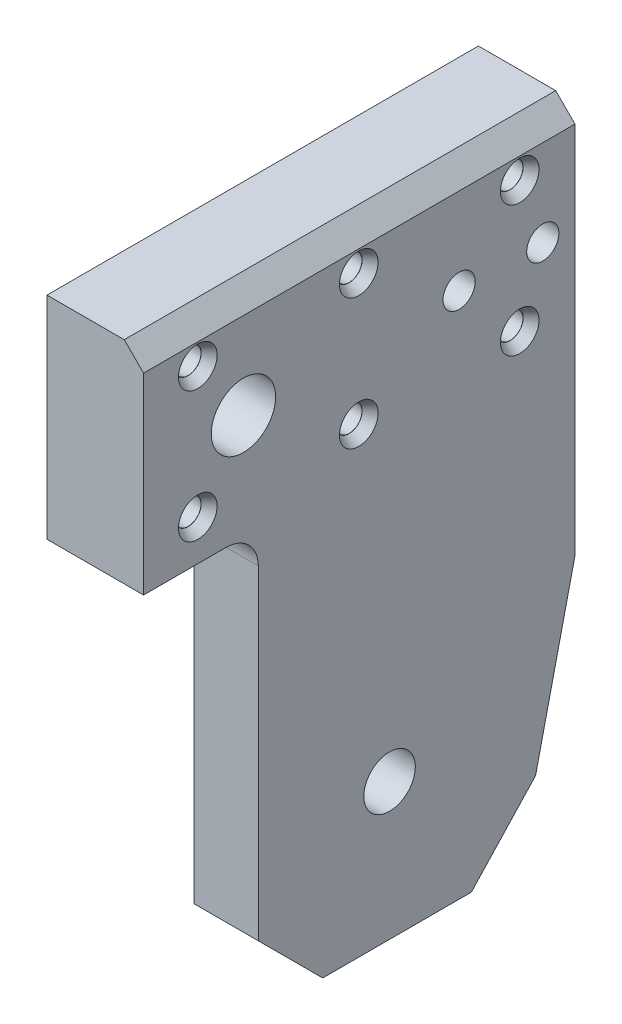
from build123d import *

# Parameters (mm, degrees)
SKETCH_1_R                      = 4
EXTRUDE_1_DEPTH                 = 15
SKETCH_4_W                      = 59.231964801
SKETCH_4_H                      = 71.825442386
CUT_EXTRUDE_3_DEPTH             = 5
SKETCH_5_R                      = 5
SKETCH_5_R_2                    = 2.5
CUT_EXTRUDE_1_DEPTH             = 109.069666358
CHAMFER_1_SIZE                  = 10
CHAMFER_2_SIZE                  = 7.5
CHAMFER_2_SIZE2                 = 10.967511122
FILLET_1_R                      = 5
SKETCH_6_R                      = 2
CUT_EXTRUDE_2_DEPTH             = 109.069666358
SKETCH_7_R                      = 3
CUT_EXTRUDE_3_2_DEPTH           = 1.5
CUT_EXTRUDE_3_2_DRAFT           = -33
CUT_EXTRUDE_3_2_PROFILE_2_DEPTH = 1.5
CUT_EXTRUDE_3_2_PROFILE_2_DRAFT = -33
CUT_EXTRUDE_3_2_PROFILE_3_DEPTH = 1.5
CUT_EXTRUDE_3_2_PROFILE_3_DRAFT = -33
CUT_EXTRUDE_3_2_PROFILE_4_DEPTH = 1.5
CUT_EXTRUDE_3_2_PROFILE_4_DRAFT = -33
CUT_EXTRUDE_3_2_PROFILE_5_DEPTH = 1.5
CUT_EXTRUDE_3_2_PROFILE_5_DRAFT = -33
CUT_EXTRUDE_3_2_PROFILE_6_DEPTH = 1.5
CUT_EXTRUDE_3_2_PROFILE_6_DRAFT = -33
CHAMFER_3_SIZE                  = 3


with BuildPart() as part:
    # Эскиз1 → Вытянуть1 (new body)
    with BuildSketch(Plane(origin=(0, 0, 0), x_dir=(0, 0, -1), z_dir=(1, 0, 0))):
        Polygon((-24.582546576, -0.000617064), (-24.582546576, -32.845704832), (-6.76628281, -32.845704832), (-6.76628281, -98.258905102), (33.827639979, -98.258905102), (42.417453424, -61.027347877), (42.417453424, -0.000617064), align=None)
        with Locations((13.620132913, -77.029686591)):
            Circle(SKETCH_1_R, mode=Mode.SUBTRACT)
    extrude(amount=EXTRUDE_1_DEPTH)

    # Эскиз4 → Cut-Extrude 3 (cut)
    with BuildSketch(Plane.ZY):
        with Locations((-12.801471023, -76.114894855)):
            Rectangle(SKETCH_4_W, SKETCH_4_H)
    extrude(amount=-CUT_EXTRUDE_3_DEPTH, mode=Mode.SUBTRACT)

    # Эскиз5 → Вырез-Вытянуть1 (cut, through all)
    with BuildSketch(Plane(origin=(15, 0, 0), x_dir=(0, 0, -1), z_dir=(1, 0, 0))):
        with Locations((-9.068801992, -16.42316095)):
            Circle(SKETCH_5_R)
        with Locations((24.417453448, -16.423160953)):
            Circle(SKETCH_5_R_2)
        with Locations((37.417453448, -16.423160948)):
            Circle(SKETCH_5_R_2)
    extrude(amount=-CUT_EXTRUDE_1_DEPTH, mode=Mode.SUBTRACT)

    # Фаска1
    chamfer_1_edges = [part.edges().sort_by_distance(p)[0] for p in [
        (10, -98.258905102, 6.76628281),
    ]]
    chamfer(chamfer_1_edges, length=CHAMFER_1_SIZE)

    # Фаска2
    chamfer_2_edges = [part.edges().sort_by_distance(p)[0] for p in [
        (10, -98.258905102, -33.827639979),
    ]]
    chamfer_2_side = [part.faces().sort_by_distance(p)[0] for p in [
        (10, -98.258905102, -18.530678584),
    ]]
    chamfer(chamfer_2_edges, length=CHAMFER_2_SIZE, length2=CHAMFER_2_SIZE2, reference=chamfer_2_side[0])

    # Скругление1
    fillet_1_edges = [part.edges().sort_by_distance(p)[0] for p in [
        (7.5, -32.845704832, 6.76628281),
    ]]
    fillet(fillet_1_edges, radius=FILLET_1_R)

    # Эскиз6 → Вырез-Вытянуть2 (cut, through all)
    with BuildSketch(Plane(origin=(15, 0, 0), x_dir=(0, 0, -1), z_dir=(1, 0, 0))):
        with Locations((-16.16411161, -6.276498114)):
            Circle(SKETCH_6_R)
        with Locations((8.83588839, -6.276498105)):
            Circle(SKETCH_6_R)
        with Locations((33.83588839, -6.276498095)):
            Circle(SKETCH_6_R)
        with Locations((-16.164111603, -26.569823822)):
            Circle(SKETCH_6_R)
        with Locations((8.835888397, -26.569823813)):
            Circle(SKETCH_6_R)
        with Locations((33.835888397, -26.569823803)):
            Circle(SKETCH_6_R)
    extrude(amount=-CUT_EXTRUDE_2_DEPTH, mode=Mode.SUBTRACT)


with BuildPart() as cut_extrude_3_2_tool:
    # Эскиз7 → Cut-Extrude 3 2 (with draft: the straight prism first)
    with BuildSketch(Plane(origin=(15, 0, 0), x_dir=(0, 0, -1), z_dir=(1, 0, 0))):
        with Locations((-16.16411161, -6.276498114)):
            Circle(SKETCH_7_R)
    extrude(amount=-CUT_EXTRUDE_3_2_DEPTH)
    # Cut-Extrude 3 2: the draft: its side faces are tilted about the plane it starts from
    cut_extrude_3_2_sides = [cut_extrude_3_2_tool.faces().sort_by_distance(p)[0] for p in [
        (14.25, -6.276498114, 19.16411161),
    ]]
    draft(cut_extrude_3_2_sides, Plane(origin=(15, 0, 0), x_dir=(0, 0, -1), z_dir=(1, 0, 0)), CUT_EXTRUDE_3_2_DRAFT)


with BuildPart() as part_1:
    add(part.part)

    # Cut-Extrude 3 2: cut by cut_extrude_3_2_tool
    add(cut_extrude_3_2_tool.part, mode=Mode.SUBTRACT)


with BuildPart() as cut_extrude_3_2_profile_2_tool:
    # Эскиз7 → Cut-Extrude 3 2 profile 2 (with draft: the straight prism first)
    with BuildSketch(Plane(origin=(15, 0, 0), x_dir=(0, 0, -1), z_dir=(1, 0, 0))):
        with Locations((8.83588839, -6.276498105)):
            Circle(SKETCH_7_R)
    extrude(amount=-CUT_EXTRUDE_3_2_PROFILE_2_DEPTH)
    # Cut-Extrude 3 2 profile 2: the draft: its side faces are tilted about the plane it starts from
    cut_extrude_3_2_profile_2_sides = [cut_extrude_3_2_profile_2_tool.faces().sort_by_distance(p)[0] for p in [
        (14.25, -6.276498105, -5.83588839),
    ]]
    draft(cut_extrude_3_2_profile_2_sides, Plane(origin=(15, 0, 0), x_dir=(0, 0, -1), z_dir=(1, 0, 0)), CUT_EXTRUDE_3_2_PROFILE_2_DRAFT)


with BuildPart() as part_2:
    add(part_1.part)

    # Cut-Extrude 3 2 profile 2: cut by cut_extrude_3_2_profile_2_tool
    add(cut_extrude_3_2_profile_2_tool.part, mode=Mode.SUBTRACT)


with BuildPart() as cut_extrude_3_2_profile_3_tool:
    # Эскиз7 → Cut-Extrude 3 2 profile 3 (with draft: the straight prism first)
    with BuildSketch(Plane(origin=(15, 0, 0), x_dir=(0, 0, -1), z_dir=(1, 0, 0))):
        with Locations((33.83588839, -6.276498095)):
            Circle(SKETCH_7_R)
    extrude(amount=-CUT_EXTRUDE_3_2_PROFILE_3_DEPTH)
    # Cut-Extrude 3 2 profile 3: the draft: its side faces are tilted about the plane it starts from
    cut_extrude_3_2_profile_3_sides = [cut_extrude_3_2_profile_3_tool.faces().sort_by_distance(p)[0] for p in [
        (14.25, -6.276498095, -30.83588839),
    ]]
    draft(cut_extrude_3_2_profile_3_sides, Plane(origin=(15, 0, 0), x_dir=(0, 0, -1), z_dir=(1, 0, 0)), CUT_EXTRUDE_3_2_PROFILE_3_DRAFT)


with BuildPart() as part_3:
    add(part_2.part)

    # Cut-Extrude 3 2 profile 3: cut by cut_extrude_3_2_profile_3_tool
    add(cut_extrude_3_2_profile_3_tool.part, mode=Mode.SUBTRACT)


with BuildPart() as cut_extrude_3_2_profile_4_tool:
    # Эскиз7 → Cut-Extrude 3 2 profile 4 (with draft: the straight prism first)
    with BuildSketch(Plane(origin=(15, 0, 0), x_dir=(0, 0, -1), z_dir=(1, 0, 0))):
        with Locations((-16.164111603, -26.569823822)):
            Circle(SKETCH_7_R)
    extrude(amount=-CUT_EXTRUDE_3_2_PROFILE_4_DEPTH)
    # Cut-Extrude 3 2 profile 4: the draft: its side faces are tilted about the plane it starts from
    cut_extrude_3_2_profile_4_sides = [cut_extrude_3_2_profile_4_tool.faces().sort_by_distance(p)[0] for p in [
        (14.25, -26.569823822, 19.164111603),
    ]]
    draft(cut_extrude_3_2_profile_4_sides, Plane(origin=(15, 0, 0), x_dir=(0, 0, -1), z_dir=(1, 0, 0)), CUT_EXTRUDE_3_2_PROFILE_4_DRAFT)


with BuildPart() as part_4:
    add(part_3.part)

    # Cut-Extrude 3 2 profile 4: cut by cut_extrude_3_2_profile_4_tool
    add(cut_extrude_3_2_profile_4_tool.part, mode=Mode.SUBTRACT)


with BuildPart() as cut_extrude_3_2_profile_5_tool:
    # Эскиз7 → Cut-Extrude 3 2 profile 5 (with draft: the straight prism first)
    with BuildSketch(Plane(origin=(15, 0, 0), x_dir=(0, 0, -1), z_dir=(1, 0, 0))):
        with Locations((8.835888397, -26.569823813)):
            Circle(SKETCH_7_R)
    extrude(amount=-CUT_EXTRUDE_3_2_PROFILE_5_DEPTH)
    # Cut-Extrude 3 2 profile 5: the draft: its side faces are tilted about the plane it starts from
    cut_extrude_3_2_profile_5_sides = [cut_extrude_3_2_profile_5_tool.faces().sort_by_distance(p)[0] for p in [
        (14.25, -26.569823813, -5.835888397),
    ]]
    draft(cut_extrude_3_2_profile_5_sides, Plane(origin=(15, 0, 0), x_dir=(0, 0, -1), z_dir=(1, 0, 0)), CUT_EXTRUDE_3_2_PROFILE_5_DRAFT)


with BuildPart() as part_5:
    add(part_4.part)

    # Cut-Extrude 3 2 profile 5: cut by cut_extrude_3_2_profile_5_tool
    add(cut_extrude_3_2_profile_5_tool.part, mode=Mode.SUBTRACT)


with BuildPart() as cut_extrude_3_2_profile_6_tool:
    # Эскиз7 → Cut-Extrude 3 2 profile 6 (with draft: the straight prism first)
    with BuildSketch(Plane(origin=(15, 0, 0), x_dir=(0, 0, -1), z_dir=(1, 0, 0))):
        with Locations((33.835888397, -26.569823803)):
            Circle(SKETCH_7_R)
    extrude(amount=-CUT_EXTRUDE_3_2_PROFILE_6_DEPTH)
    # Cut-Extrude 3 2 profile 6: the draft: its side faces are tilted about the plane it starts from
    cut_extrude_3_2_profile_6_sides = [cut_extrude_3_2_profile_6_tool.faces().sort_by_distance(p)[0] for p in [
        (14.25, -26.569823803, -30.835888397),
    ]]
    draft(cut_extrude_3_2_profile_6_sides, Plane(origin=(15, 0, 0), x_dir=(0, 0, -1), z_dir=(1, 0, 0)), CUT_EXTRUDE_3_2_PROFILE_6_DRAFT)


with BuildPart() as part_6:
    add(part_5.part)

    # Cut-Extrude 3 2 profile 6: cut by cut_extrude_3_2_profile_6_tool
    add(cut_extrude_3_2_profile_6_tool.part, mode=Mode.SUBTRACT)

    # Фаска3
    chamfer_3_edges = [part_6.edges().sort_by_distance(p)[0] for p in [
        (15, -0.000617064, -8.917453424),
    ]]
    chamfer(chamfer_3_edges, length=CHAMFER_3_SIZE)


solid = part_6.part
